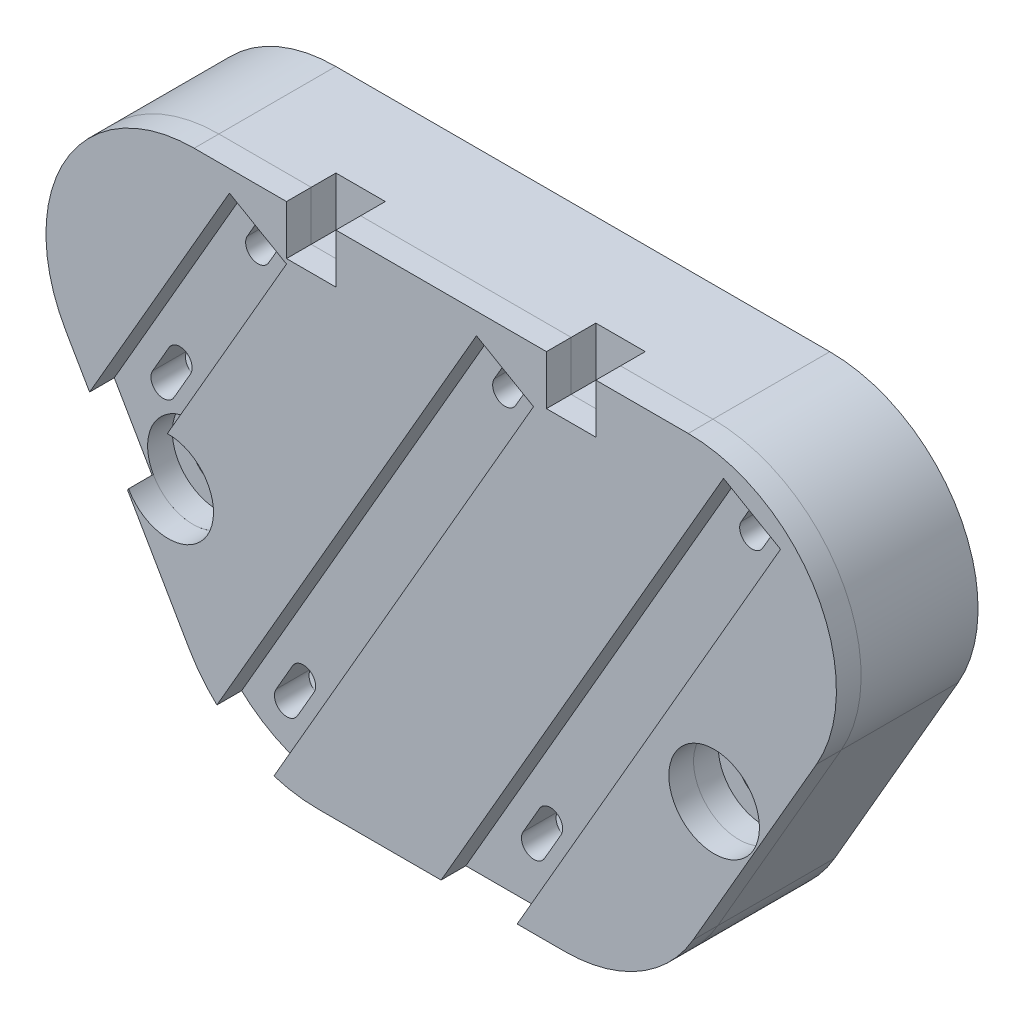
from build123d import *

# Parameters (mm, degrees)
BOSS_EXTRUDE1_DEPTH   = 5
BOSS_EXTRUDE1_2_DEPTH = 5
BOSS_EXTRUDE1_3_DEPTH = 5
BOSS_EXTRUDE1_4_DEPTH = 5
BOSS_EXTRUDE2_DEPTH   = 2.1
BOSS_EXTRUDE3_DEPTH   = 1.5
SKETCH6_W             = 3
SKETCH6_H             = 3
CUT_EXTRUDE1_DEPTH    = 3
SKETCH7_R             = 2.75
CUT_EXTRUDE5_DEPTH    = 3
SKETCH8_R             = 1.55
CUT_EXTRUDE6_DEPTH    = 46.121357017


with BuildPart() as part:
    # Sketch1 → Boss-Extrude1 (new body)
    with BuildSketch(Plane.XY):
        with BuildLine():
            ThreePointArc((7.794228634, -4.5), (7.794228634, 4.5), (0, 9))
            Line((0, 9), (-30, 9))
            ThreePointArc((-30, 9), (-37.794228634, 4.5), (-37.794228634, -4.5))
            Line((-37.794228634, -4.5), (-30.294228634, -17.490381057))
            ThreePointArc((-30.294228634, -17.490381057), (-27, -20.784609691), (-22.5, -21.990381057))
            Line((-22.5, -21.990381057), (-7.5, -21.990381057))
            ThreePointArc((-7.5, -21.990381057), (-3, -20.784609691), (0.294228634, -17.490381057))
            Line((0.294228634, -17.490381057), (7.794228634, -4.5))
        make_face()
        with BuildLine():
            ThreePointArc((-3.749999955, -6.495190554), (-3.750000023, -19.485571598), (-15, -12.990381057))
            ThreePointArc((-15, -12.990381057), (-26.250000054, -19.485571554), (-26.249999891, -6.495190466))
            ThreePointArc((-26.249999891, -6.495190466), (-36.49519056, 3.749999946), (-22.5, 0))
            ThreePointArc((-22.5, 0), (-15, 7.5), (-7.5, 0))
            ThreePointArc((-7.5, 0), (6.495190515, 3.750000023), (-3.749999955, -6.495190554))
        make_face(mode=Mode.SUBTRACT)
    extrude(amount=BOSS_EXTRUDE1_DEPTH)

    # Sketch2 → Boss-Extrude2 (add)
    with BuildSketch(Plane.XY.offset(5)):
        with BuildLine():
            Line((-22.5, -21.990381057), (-7.5, -21.990381057))
            ThreePointArc((-7.5, -21.990381057), (-3, -20.784609691), (0.294228634, -17.490381057))
            Line((0.294228634, -17.490381057), (7.794228634, -4.5))
            ThreePointArc((7.794228634, -4.5), (7.794228634, 4.5), (0, 9))
            Line((0, 9), (-30, 9))
            ThreePointArc((-30, 9), (-37.794228634, 4.5), (-37.794228634, -4.5))
            Line((-37.794228634, -4.5), (-30.294228634, -17.490381057))
            ThreePointArc((-30.294228634, -17.490381057), (-27, -20.784609691), (-22.5, -21.990381057))
        make_face()
        with BuildLine():
            Line((-28.274519053, 4.488620668), (-27.274519053, 6.220671476))
            ThreePointArc((-27.274519053, 6.220671476), (-26.25, 6.495190528), (-25.975480947, 5.470671476))
            Line((-25.975480947, 5.470671476), (-26.975480947, 3.738620668))
            ThreePointArc((-26.975480947, 3.738620668), (-28, 3.464101615), (-28.274519053, 4.488620668))
        make_face(mode=Mode.SUBTRACT)
        with BuildLine():
            Line((-31.725480947, -4.488620668), (-32.725480947, -6.220671476))
            ThreePointArc((-32.725480947, -6.220671476), (-33.75, -6.495190528), (-34.024519053, -5.470671476))
            Line((-34.024519053, -5.470671476), (-33.024519053, -3.738620668))
            ThreePointArc((-33.024519053, -3.738620668), (-32, -3.464101615), (-31.725480947, -4.488620668))
        make_face(mode=Mode.SUBTRACT)
        with BuildLine():
            Line((-24.225480947, -17.479001725), (-25.225480947, -19.211052532))
            ThreePointArc((-25.225480947, -19.211052532), (-26.25, -19.485571585), (-26.524519053, -18.461052532))
            Line((-26.524519053, -18.461052532), (-25.524519053, -16.729001725))
            ThreePointArc((-25.524519053, -16.729001725), (-24.5, -16.454482672), (-24.225480947, -17.479001725))
        make_face(mode=Mode.SUBTRACT)
        with BuildLine():
            Line((-13.274519053, 4.488620668), (-12.274519053, 6.220671476))
            ThreePointArc((-12.274519053, 6.220671476), (-11.25, 6.495190528), (-10.975480947, 5.470671476))
            Line((-10.975480947, 5.470671476), (-11.975480947, 3.738620668))
            ThreePointArc((-11.975480947, 3.738620668), (-13, 3.464101615), (-13.274519053, 4.488620668))
        make_face(mode=Mode.SUBTRACT)
        with BuildLine():
            Line((-9.225480947, -17.479001725), (-10.225480947, -19.211052532))
            ThreePointArc((-10.225480947, -19.211052532), (-11.25, -19.485571585), (-11.524519053, -18.461052532))
            Line((-11.524519053, -18.461052532), (-10.524519053, -16.729001725))
            ThreePointArc((-10.524519053, -16.729001725), (-9.5, -16.454482672), (-9.225480947, -17.479001725))
        make_face(mode=Mode.SUBTRACT)
        with BuildLine():
            Line((1.725480947, 4.488620668), (2.725480947, 6.220671476))
            ThreePointArc((2.725480947, 6.220671476), (3.75, 6.495190528), (4.024519053, 5.470671476))
            Line((4.024519053, 5.470671476), (3.024519053, 3.738620668))
            ThreePointArc((3.024519053, 3.738620668), (2, 3.464101615), (1.725480947, 4.488620668))
        make_face(mode=Mode.SUBTRACT)
    extrude(amount=BOSS_EXTRUDE2_DEPTH)


with BuildPart() as body_2:
    # Sketch1 → Boss-Extrude1 2 (new body)
    with BuildSketch(Plane.XY):
        with BuildLine():
            ThreePointArc((-18.749999869, -6.495190604), (-16.004809434, -9.240381123), (-15, -12.990381057))
            ThreePointArc((-15, -12.990381057), (-13.995190507, -9.240381019), (-11.249999925, -6.495190485))
            ThreePointArc((-11.249999925, -6.495190485), (-14.999999881, -7.5), (-18.749999869, -6.495190604))
        make_face()
    extrude(amount=BOSS_EXTRUDE1_2_DEPTH)


with BuildPart() as body_3:
    # Sketch1 → Boss-Extrude1 3 (new body)
    with BuildSketch(Plane.XY):
        with BuildLine():
            ThreePointArc((-26.249999891, -6.495190466), (-22.499999861, -5.490381057), (-18.749999869, -6.495190604))
            ThreePointArc((-18.749999869, -6.495190604), (-21.49519049, -3.750000066), (-22.5, 0))
            ThreePointArc((-22.5, 0), (-23.50480944, -3.749999946), (-26.249999891, -6.495190466))
        make_face()
    extrude(amount=BOSS_EXTRUDE1_3_DEPTH)


with BuildPart() as body_4:
    # Sketch1 → Boss-Extrude1 4 (new body)
    with BuildSketch(Plane.XY):
        with BuildLine():
            ThreePointArc((-7.5, 0), (-8.50480945, -3.749999963), (-11.249999925, -6.495190485))
            ThreePointArc((-11.249999925, -6.495190485), (-7.499999931, -5.490381057), (-3.749999955, -6.495190554))
            ThreePointArc((-3.749999955, -6.495190554), (-6.495190515, -3.750000023), (-7.5, 0))
        make_face()
    extrude(amount=BOSS_EXTRUDE1_4_DEPTH)


with BuildPart() as body_5:
    # Sketch3 → Boss-Extrude3 (new body)
    with BuildSketch(Plane.XY.offset(7.1)):
        with BuildLine():
            Line((-37.794228634, -4.5), (-36.350852961, -7))
            Line((-36.350852961, -7), (-27.857050808, 7.711696879))
            Line((-27.857050808, 7.711696879), (-24.392949192, 5.711696879))
            Line((-24.392949192, 5.711696879), (-34.041451884, -11))
            Line((-34.041451884, -11), (-30.294228634, -17.490381057))
            ThreePointArc((-30.294228634, -17.490381057), (-29.53562364, -18.602867137), (-28.619533001, -19.589723134))
            Line((-28.619533001, -19.589723134), (-12.857050808, 7.711696879))
            Line((-12.857050808, 7.711696879), (-9.392949192, 5.711696879))
            Line((-9.392949192, 5.711696879), (-25.155431386, -21.589723134))
            ThreePointArc((-25.155431386, -21.589723134), (-23.842743704, -21.8896529), (-22.5, -21.990381057))
            Line((-22.5, -21.990381057), (-15.005553499, -21.990381057))
            Line((-15.005553499, -21.990381057), (2.142949192, 7.711696879))
            Line((2.142949192, 7.711696879), (5.607050808, 5.711696879))
            Line((5.607050808, 5.711696879), (-10.386751346, -21.990381057))
            Line((-10.386751346, -21.990381057), (-7.5, -21.990381057))
            ThreePointArc((-7.5, -21.990381057), (-3, -20.784609691), (0.294228634, -17.490381057))
            Line((0.294228634, -17.490381057), (7.794228634, -4.5))
            ThreePointArc((7.794228634, -4.5), (7.794228634, 4.5), (0, 9))
            Line((0, 9), (-30, 9))
            ThreePointArc((-30, 9), (-37.794228634, 4.5), (-37.794228634, -4.5))
        make_face()
    extrude(amount=BOSS_EXTRUDE3_DEPTH)


with BuildPart() as cut_extrude1_tool:
    # Sketch6 → Cut-Extrude1 (new body)
    with BuildSketch(Plane(origin=(0, 0, 8.6), x_dir=(-1, 0, 0), z_dir=(0, 0, -1))):
        with Locations((7.108126012, 7.5)):
            Rectangle(SKETCH6_W, SKETCH6_H)
        with Locations((22.892949192, 7.5)):
            Rectangle(SKETCH6_W, SKETCH6_H)
    extrude(amount=CUT_EXTRUDE1_DEPTH)


with BuildPart() as part_1:
    add(part.part)

    # Cut-Extrude1: cut by cut_extrude1_tool
    add(cut_extrude1_tool.part, mode=Mode.SUBTRACT)


with BuildPart() as body_5_1:
    add(body_5.part)

    # Cut-Extrude1: cut by cut_extrude1_tool
    add(cut_extrude1_tool.part, mode=Mode.SUBTRACT)


with BuildPart() as cut_extrude5_tool:
    # Sketch7 → Cut-Extrude5 (new body)
    with BuildSketch(Plane.XY.offset(8.6)):
        with Locations((-31.576056233, -9.570190528)):
            Circle(SKETCH7_R)
        with Locations((1.574981029, -9.570190528)):
            Circle(SKETCH7_R)
    extrude(amount=-CUT_EXTRUDE5_DEPTH)


with BuildPart() as part_2:
    add(part_1.part)

    # Cut-Extrude5: cut by cut_extrude5_tool
    add(cut_extrude5_tool.part, mode=Mode.SUBTRACT)

    # Sketch8 → Cut-Extrude6 (cut, through all)
    with BuildSketch(Plane.XY.offset(5.6)):
        with Locations((1.574981029, -9.570190528)):
            Circle(SKETCH8_R)
        with Locations((-31.576056233, -9.570190528)):
            Circle(SKETCH8_R)
    extrude(amount=-CUT_EXTRUDE6_DEPTH, mode=Mode.SUBTRACT)


with BuildPart() as body_5_2:
    add(body_5_1.part)

    # Cut-Extrude5: cut by cut_extrude5_tool
    add(cut_extrude5_tool.part, mode=Mode.SUBTRACT)


solid = Compound([body_2.part, body_3.part, body_4.part, part_2.part, body_5_2.part])
